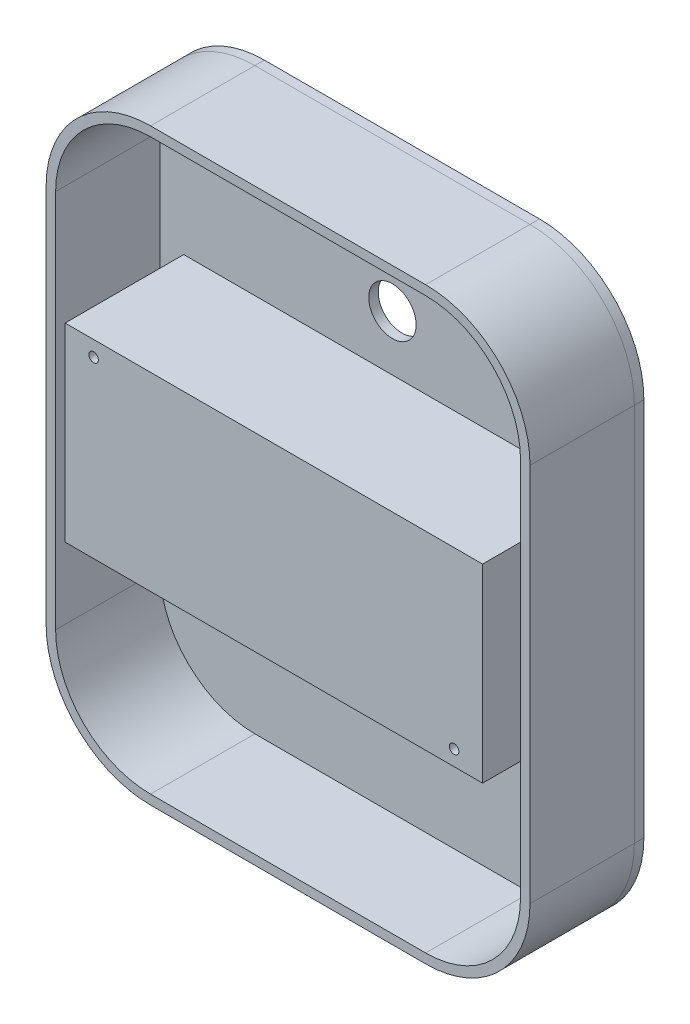
from build123d import *

# Parameters (mm, degrees)
BOSS_EXTRUDE1_DEPTH = 22
SKETCH3_W           = 88
SKETCH3_H           = 40
SKETCH3_R           = 1
BOSS_EXTRUDE2_DEPTH = 25
BOSS_EXTRUDE3_START = -2
SKETCH6_R           = 1.75
SKETCH6_R_2         = 5
BOSS_EXTRUDE3_DEPTH = 2


with BuildPart() as part:
    # Sketch1 → Boss-Extrude1 (new body)
    with BuildSketch(Plane.XY):
        with BuildLine():
            Line((-29, 62), (29, 62))
            ThreePointArc((29, 62), (44.556349186, 55.556349186), (51, 40))
            Line((51, 40), (51, -40))
            ThreePointArc((51, -40), (44.556349186, -55.556349186), (29, -62))
            Line((29, -62), (-29, -62))
            ThreePointArc((-29, -62), (-44.556349186, -55.556349186), (-51, -40))
            Line((-51, -40), (-51, 40))
            ThreePointArc((-51, 40), (-44.556349186, 55.556349186), (-29, 62))
        make_face()
        with BuildLine():
            Line((-29, 60), (29, 60))
            ThreePointArc((29, 60), (43.142135624, 54.142135624), (49, 40))
            Line((49, 40), (49, -40))
            ThreePointArc((49, -40), (43.142135624, -54.142135624), (29, -60))
            Line((29, -60), (-29, -60))
            ThreePointArc((-29, -60), (-43.142135624, -54.142135624), (-49, -40))
            Line((-49, -40), (-49, 40))
            ThreePointArc((-49, 40), (-43.142135624, 54.142135624), (-29, 60))
        make_face(mode=Mode.SUBTRACT)
    extrude(amount=BOSS_EXTRUDE1_DEPTH)


with BuildPart() as body_2:
    # Sketch3 → Boss-Extrude2 (new body)
    with BuildSketch(Plane.XY):
        Rectangle(SKETCH3_W, SKETCH3_H)
        with Locations((-38, 16.75)):
            Circle(SKETCH3_R, mode=Mode.SUBTRACT)
        with Locations((38, -16.75)):
            Circle(SKETCH3_R, mode=Mode.SUBTRACT)
    extrude(amount=BOSS_EXTRUDE2_DEPTH)

    # Sketch6 → Boss-Extrude3 (add)
    with BuildSketch(Plane.XY.offset(BOSS_EXTRUDE3_START)):
        with BuildLine():
            Line((-29, 62), (29, 62))
            ThreePointArc((29, 62), (44.556349186, 55.556349186), (51, 40))
            Line((51, 40), (51, -40))
            ThreePointArc((51, -40), (44.556349186, -55.556349186), (29, -62))
            Line((29, -62), (-29, -62))
            ThreePointArc((-29, -62), (-44.556349186, -55.556349186), (-51, -40))
            Line((-51, -40), (-51, 40))
            ThreePointArc((-51, 40), (-44.556349186, 55.556349186), (-29, 62))
        make_face()
        with Locations((0, 41)):
            Circle(SKETCH6_R, mode=Mode.SUBTRACT)
        with Locations((0, -41)):
            Circle(SKETCH6_R, mode=Mode.SUBTRACT)
        with Locations((0, 31.659632999)):
            Circle(SKETCH6_R_2, mode=Mode.SUBTRACT)
        with Locations((0, -30.755120583)):
            Circle(SKETCH6_R_2, mode=Mode.SUBTRACT)
    extrude(amount=BOSS_EXTRUDE3_DEPTH)


solid = Compound([part.part, body_2.part])
